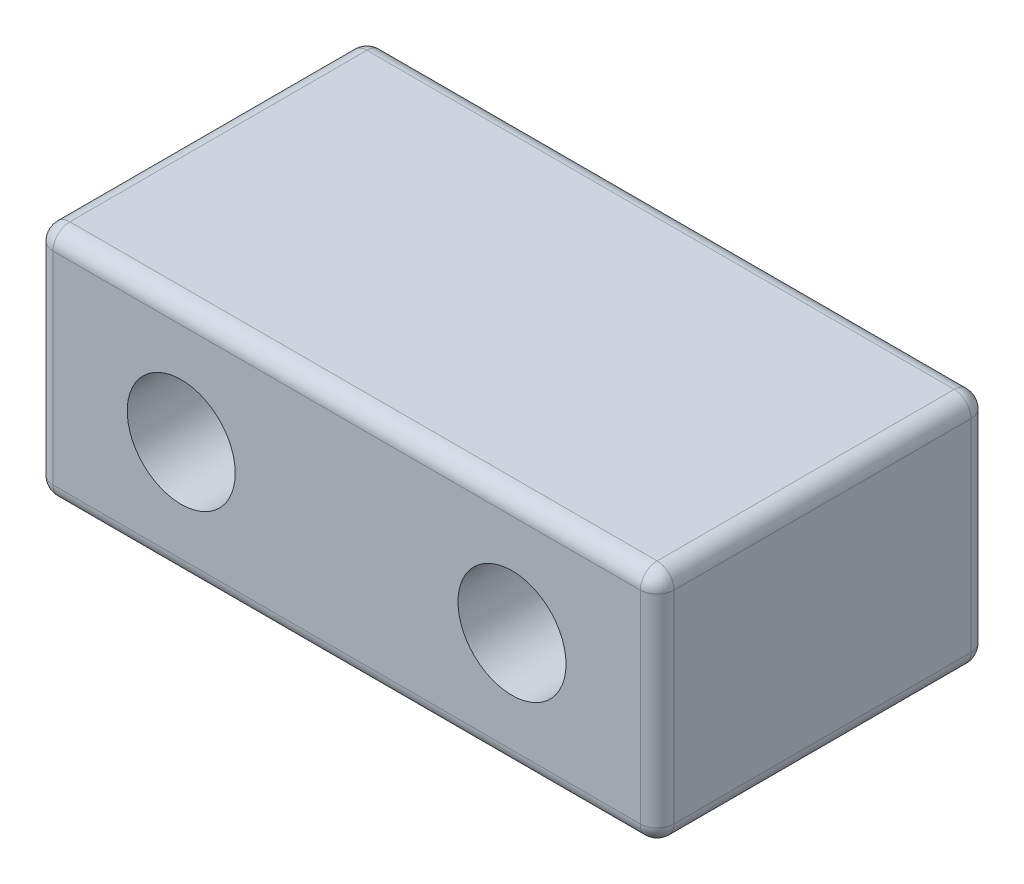
from build123d import *

# Parameters (mm, degrees)
SKETCH_1_W          = 18.4
SKETCH_1_H          = 7
EXTRUDE_1_DEPTH     = 9.8
SKETCH_2_R          = 1.6
CUT_EXTRUDE_1_DEPTH = 9.8
FILLET_1_R          = 0.5


with BuildPart() as part:
    # 草图1 → 凸台-拉伸1 (new body)
    with BuildSketch(Plane.XY):
        with Locations((9.2, 3.5)):
            Rectangle(SKETCH_1_W, SKETCH_1_H)
    extrude(amount=EXTRUDE_1_DEPTH)

    # 草图2 → 切除-拉伸1 (cut)
    with BuildSketch(Plane.XY.offset(9.8)):
        with Locations((4.3, 3.5)):
            Circle(SKETCH_2_R)
        with Locations((14.1, 3.5)):
            Circle(SKETCH_2_R)
    extrude(amount=-CUT_EXTRUDE_1_DEPTH, mode=Mode.SUBTRACT)

    # 圆角1
    fillet_1_edges = [part.edges().sort_by_distance(p)[0] for p in [
        (18.4, 3.5, 9.8),
        (9.2, 7, 9.8),
        (0, 3.5, 9.8),
        (9.2, 7, 0),
        (18.4, 3.5, 0),
        (9.2, 0, 0),
        (0, 3.5, 0),
        (0, 7, 4.9),
        (18.4, 7, 4.9),
        (18.4, 0, 4.9),
        (0, 0, 4.9),
        (9.2, 0, 9.8),
    ]]
    fillet(fillet_1_edges, radius=FILLET_1_R)


solid = part.part
